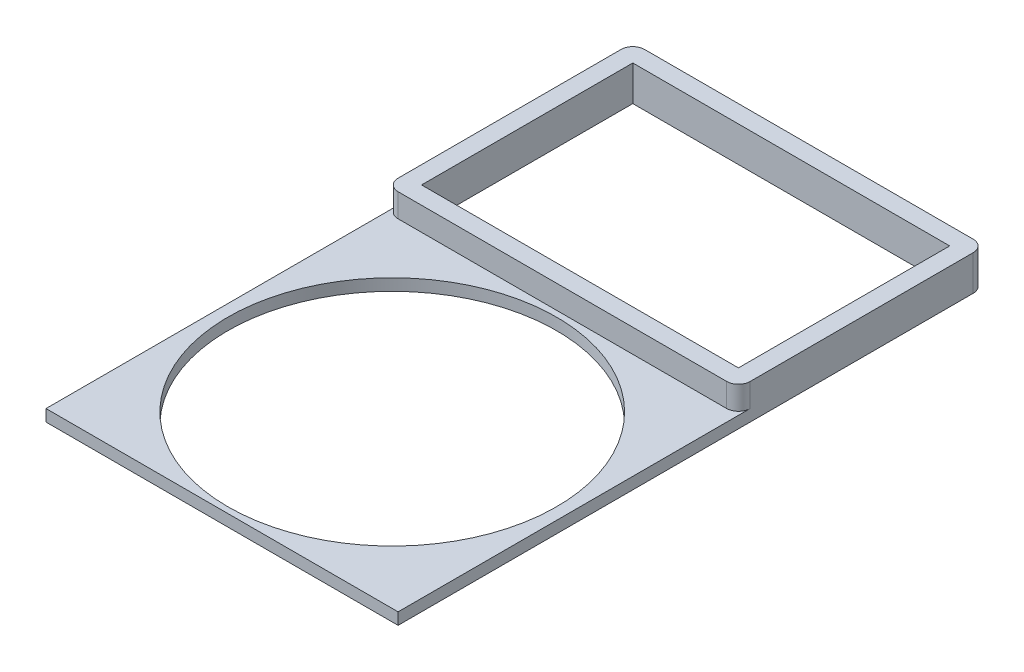
from build123d import *

# Parameters (mm, degrees)
ESQUISSE1_W        = 30
ESQUISSE1_H        = 50
ESQUISSE1_R        = 14
ESQUISSE1_W_2      = 27
ESQUISSE1_H_2      = 18
BOSS_EXTRU_1_DEPTH = 1
ESQUISSE2_W        = 30
ESQUISSE2_H        = 21
ESQUISSE2_W_2      = 27
ESQUISSE2_H_2      = 18
BOSS_EXTRU_2_DEPTH = 2
CONG_1_R           = 1


with BuildPart() as part:
    # Esquisse1 → Boss.-Extru.1 (new body)
    with BuildSketch(Plane(origin=(0, 0, 0), x_dir=(1, 0, 0), z_dir=(0, 1, 0))):
        Rectangle(ESQUISSE1_W, ESQUISSE1_H)
        with Locations(Location((0, -10.5, 0), (0, 0, 270))):
            Circle(ESQUISSE1_R, mode=Mode.SUBTRACT)
        with Locations((0, 14.5)):
            Rectangle(ESQUISSE1_W_2, ESQUISSE1_H_2, mode=Mode.SUBTRACT)
    extrude(amount=BOSS_EXTRU_1_DEPTH)

    # Esquisse2 → Boss.-Extru.2 (add)
    with BuildSketch(Plane(origin=(0, 1, 0), x_dir=(1, 0, 0), z_dir=(0, 1, 0))):
        with Locations((0, 14.5)):
            Rectangle(ESQUISSE2_W, ESQUISSE2_H)
        with Locations((0, 14.5)):
            Rectangle(ESQUISSE2_W_2, ESQUISSE2_H_2, mode=Mode.SUBTRACT)
    extrude(amount=BOSS_EXTRU_2_DEPTH)

    # Congé1
    cong_1_edges = [part.edges().sort_by_distance(p)[0] for p in [
        (-15, 1.5, -25),
        (-15, 2, -4),
        (15, 1.5, -25),
        (15, 2, -4),
    ]]
    fillet(cong_1_edges, radius=CONG_1_R)


solid = part.part
